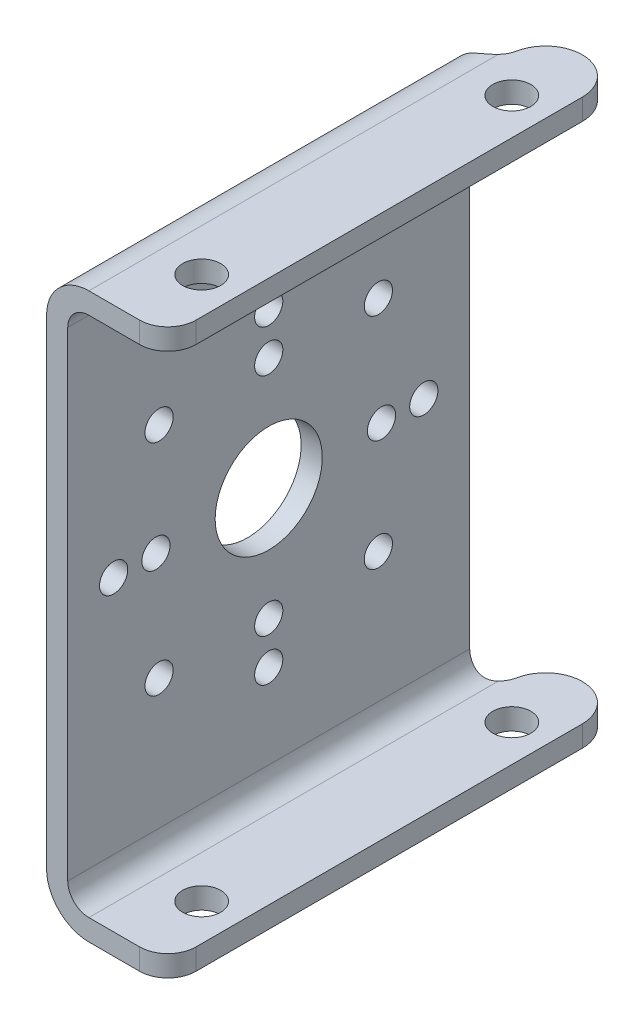
from build123d import *

# Parameters (mm, degrees)
BOSS_EXTRUDE1_DEPTH = 16
SKETCH2_R           = 1.35
CUT_EXTRUDE1_DEPTH  = 44.931310019
SKETCH4_R           = 1.742727666
CUT_EXTRUDE3_DEPTH  = 44.931310019
SKETCH3_R           = 3.8
CUT_EXTRUDE2_DEPTH  = 44.931310019
FILLET1_R           = 3
FILLET2_R           = 2
FILLET3_R           = 1.5
CUT_EXTRUDE4_REACH  = 45.662
SKETCH5_R           = 1
CIRPATTERN1_COUNT   = 8
SKETCH6_R           = 1
CUT_EXTRUDE5_DEPTH  = 44.662455396
CIRPATTERN2_COUNT   = 4


with BuildPart() as part:
    # Sketch1 → Boss-Extrude1 (new, symmetric)
    with BuildSketch(Plane.XY):
        Polygon((0, 0), (0, 40), (8.6, 40), (8.6, 38.5), (1.5, 38.5), (1.5, 1.5), (8.6, 1.5), (8.6, 0), align=None)
    extrude(amount=BOSS_EXTRUDE1_DEPTH, both=True)

    # Sketch2 → Cut-Extrude1 (cut, through all)
    with BuildSketch(Plane(origin=(0, 40, 0), x_dir=(1, 0, 0), z_dir=(0, 1, 0))):
        with Locations(Location((6, 11, 0), (0, 0, 180))):
            Circle(SKETCH2_R)
        with Locations(Location((6, -11, 0), (0, 0, 180))):
            Circle(SKETCH2_R)
    extrude(amount=-CUT_EXTRUDE1_DEPTH, mode=Mode.SUBTRACT)

    # Sketch4 → Cut-Extrude3 (cut, through all)
    with BuildSketch(Plane(origin=(0, 40, 0), x_dir=(1, 0, 0), z_dir=(0, 1, 0))):
        with BuildLine():
            Line((8.6, 16), (6, 16))
            ThreePointArc((6, 16), (7.838477631, 15.238477631), (8.6, 13.4))
            Line((8.6, 13.4), (8.6, 16))
        make_face()
        Polygon((0, 18.566066505), (0, 16), (1.742727666, 16), (6, 16), (8.6, 16), (8.6, 13.4), (10.428656455, 13.4), (10.428656455, 18.566066505), align=None)
        with BuildLine():
            ThreePointArc((3.485455332, 14.257272334), (3.476860875, 14.084409002), (3.451162273, 13.91325066))
            ThreePointArc((3.451162273, 13.91325066), (4.352949866, 15.41177182), (6, 16))
            Line((6, 16), (1.742727666, 16))
            ThreePointArc((1.742727666, 16), (2.975022216, 15.489566884), (3.485455332, 14.257272334))
        make_face()
        with Locations((1.742727666, 14.257272334)):
            Circle(SKETCH4_R)
        with BuildLine():
            Line((0, 16), (0, 14.257272334))
            ThreePointArc((0, 14.257272334), (0.510433116, 15.489566884), (1.742727666, 16))
            Line((1.742727666, 16), (0, 16))
        make_face()
        with BuildLine():
            Line((0, 12.514544668), (1.742727666, 12.514544668))
            ThreePointArc((1.742727666, 12.514544668), (0.510433116, 13.024977784), (0, 14.257272334))
            Line((0, 14.257272334), (0, 12.514544668))
        make_face()
    extrude(amount=-CUT_EXTRUDE3_DEPTH, mode=Mode.SUBTRACT)

    # Sketch3 → Cut-Extrude2 (cut, through all)
    with BuildSketch(Plane.ZY):
        with Locations((1.742727666, 20)):
            Circle(SKETCH3_R)
    extrude(amount=-CUT_EXTRUDE2_DEPTH, mode=Mode.SUBTRACT)

    # Fillet1
    fillet1_edges = [part.edges().sort_by_distance(p)[0] for p in [
        (0, 0, 1.742727666),
        (0, 40, 1.742727666),
    ]]
    fillet(fillet1_edges, radius=FILLET1_R)

    # Fillet2
    fillet2_edges = [part.edges().sort_by_distance(p)[0] for p in [
        (8.6, 39.25, 16),
        (8.6, 0.75, 16),
    ]]
    fillet(fillet2_edges, radius=FILLET2_R)

    # Fillet3
    fillet3_edges = [part.edges().sort_by_distance(p)[0] for p in [
        (1.5, 1.5, 1.742727666),
        (1.5, 38.5, 1.742727666),
    ]]
    fillet(fillet3_edges, radius=FILLET3_R)

    # Sketch5 → Cut-Extrude4 (cut, up to next)
    with BuildSketch(Plane(origin=(1.5, 0, 0), x_dir=(0, 0, -1), z_dir=(1, 0, 0)), mode=Mode.PRIVATE) as cut_extrude4_sk1:
        with Locations(Location((-1.742727666, 31, 0), (0, 0, 90))):
            Circle(SKETCH5_R)
    cut_extrude4_tool1 = extrude(cut_extrude4_sk1.sketch, amount=-CUT_EXTRUDE4_REACH, mode=Mode.PRIVATE) & part.part
    cut_extrude4 = cut_extrude4_tool1.solids().sort_by_distance((1.5, 31, 1.742728))[0]
    add(cut_extrude4, mode=Mode.SUBTRACT)

    # CirPattern1: Cut-Extrude4 ×8 about axis
    cirpattern1_axis = Axis((0, 20, 1.742727666), (1, 0, 0))
    for i in range(1, CIRPATTERN1_COUNT):
        add(cut_extrude4.rotate(cirpattern1_axis, i * 360 / CIRPATTERN1_COUNT), mode=Mode.SUBTRACT)

    # Sketch6 → Cut-Extrude5 (cut, through all)
    with BuildSketch(Plane(origin=(1.5, 0, 0), x_dir=(0, 0, -1), z_dir=(1, 0, 0))):
        with Locations(Location((-1.742727666, 28, 0), (0, 0, 90))):
            Circle(SKETCH6_R)
    cut_extrude5 = extrude(amount=-CUT_EXTRUDE5_DEPTH, mode=Mode.SUBTRACT)

    # CirPattern2: Cut-Extrude5 ×4 about axis
    cirpattern2_axis = Axis((0, 20, 1.742727666), (1, 0, 0))
    for i in range(1, CIRPATTERN2_COUNT):
        add(cut_extrude5.rotate(cirpattern2_axis, i * 360 / CIRPATTERN2_COUNT), mode=Mode.SUBTRACT)


solid = part.part
